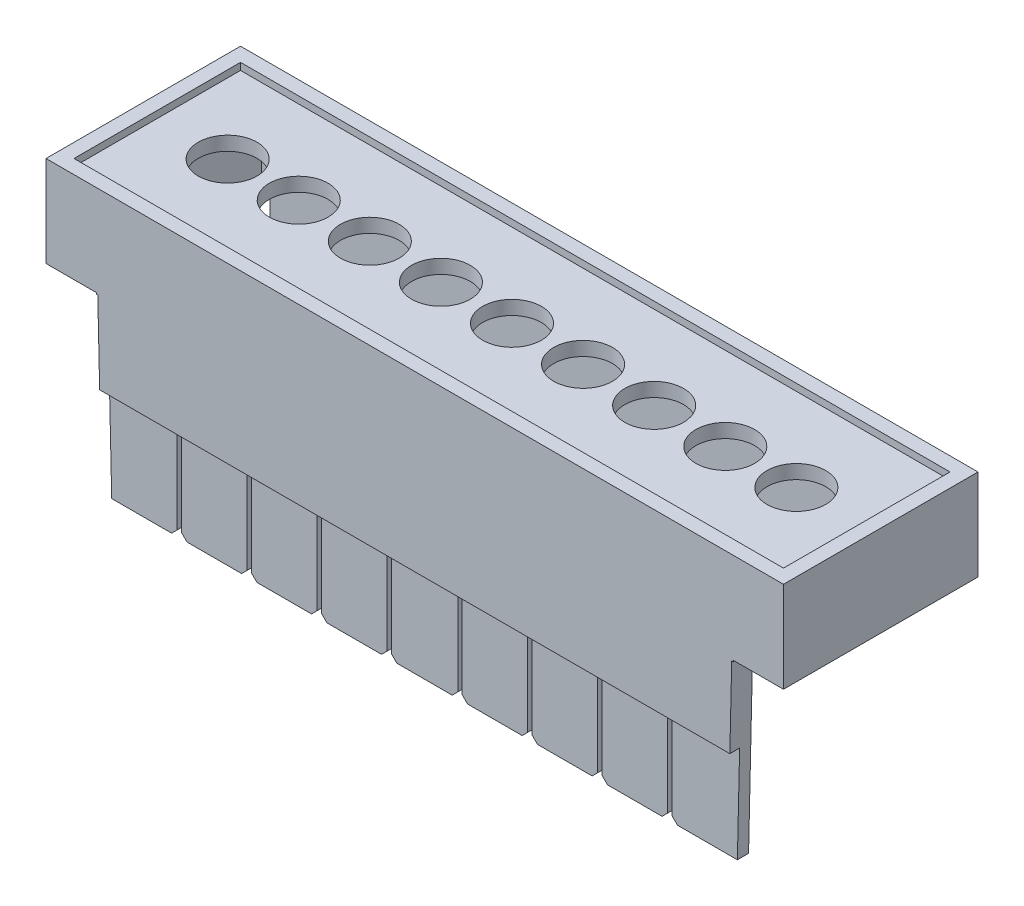
from build123d import *

# Parameters (mm, degrees)
SKETCH_1_W                 = 52.7
SKETCH_1_H                 = 13.9
EXTRUDE_1_DEPTH            = 11
SKETCH_2_W                 = 46.7
SKETCH_2_H                 = 10.9
CUT_EXTRUDE_1_DEPTH        = 9.5
SKETCH_3_W                 = 45.5
SKETCH_3_H                 = 1.5
EXTRUDE_2_DEPTH            = 8.4
SKETCH_4_W                 = 1
SKETCH_4_H                 = 7.5
CUT_EXTRUDE_2_DEPTH        = 51.794807806
CUT_EXTRUDE_3_DEPTH        = 3
PATTERN_LINEAR_1_COUNT     = 4
PATTERN_LINEAR_1_PITCH     = 5
CUT_EXTRUDE_4_DEPTH        = 3
PATTERN_LINEAR_2_COUNT     = 4
PATTERN_LINEAR_2_PITCH     = 5
SKETCH_7_W                 = 3.6
SKETCH_7_H                 = 5.5
CUT_EXTRUDE_5_DEPTH        = 32.757400712
SKETCH_8_W                 = 50.7
SKETCH_8_H                 = 11.9
CUT_EXTRUDE_6_DEPTH        = 0.5
SKETCH_9_R                 = 2.1
CUT_EXTRUDE_7_DEPTH        = 5
PATTERN_LINEAR_3_COUNT     = 5
PATTERN_LINEAR_3_PITCH     = 5.08
PATTERN_LINEAR_3_COL_COUNT = 5
PATTERN_LINEAR_3_COL_PITCH = 5.08
SKETCH_10_W                = 47.5
SKETCH_10_H                = 2
CUT_EXTRUDE_8_DEPTH        = 3
CUT_EXTRUDE_9_DEPTH        = 3


with BuildPart() as part:
    # Эскиз1 → Бобышка-Вытянуть1 (new body)
    with BuildSketch(Plane(origin=(0, 0, 0), x_dir=(1, 0, 0), z_dir=(0, 1, 0))):
        Rectangle(SKETCH_1_W, SKETCH_1_H)
    extrude(amount=EXTRUDE_1_DEPTH)

    # Эскиз2 → Вырез-Вытянуть1 (cut)
    with BuildSketch(Plane.XZ):
        Rectangle(SKETCH_2_W, SKETCH_2_H)
    extrude(amount=-CUT_EXTRUDE_1_DEPTH, mode=Mode.SUBTRACT)

    # Эскиз3 → Бобышка-Вытянуть2 (add)
    with BuildSketch(Plane.XZ):
        with Locations((0, 6.2)):
            Rectangle(SKETCH_3_W, SKETCH_3_H)
    extrude(amount=EXTRUDE_2_DEPTH)

    # Эскиз4 → Вырез-Вытянуть2 (cut, through all)
    with BuildSketch(Plane(origin=(22.75, 0, 0), x_dir=(0, 0, -1), z_dir=(1, 0, 0))):
        with Locations((-6.75, -5.15)):
            Rectangle(SKETCH_4_W, SKETCH_4_H)
    extrude(amount=-CUT_EXTRUDE_2_DEPTH, mode=Mode.SUBTRACT)

    # Эскиз5 → Вырез-Вытянуть3 (cut)
    with BuildSketch(Plane.XY.offset(6.25)):
        Polygon((-2.675, -1.4), (-2.675, -8), (-3.175, -8.5), (-3.675, -8.5), (-3.675, -9.5), (-1.375, -9.5), (-1.375, -8.5), (-1.875, -8.5), (-2.375, -8), (-2.375, -1.4), align=None)
    cut_extrude_3 = extrude(amount=-CUT_EXTRUDE_3_DEPTH, mode=Mode.SUBTRACT)

    # Линейный массив1: Вырез-Вытянуть3 ×4
    with Locations(*[(-i * PATTERN_LINEAR_1_PITCH, 0, 0) for i in range(1, PATTERN_LINEAR_1_COUNT)]):
        add(cut_extrude_3, mode=Mode.SUBTRACT)

    # Эскиз6 → Вырез-Вытянуть4 (cut)
    with BuildSketch(Plane.XY.offset(6.25)):
        Polygon((2.375, -1.4), (2.675, -1.4), (2.675, -8), (3.175, -8.5), (3.675, -8.5), (3.675, -9), (1.375, -9), (1.375, -8.5), (1.875, -8.5), (2.375, -8), align=None)
    cut_extrude_4 = extrude(amount=-CUT_EXTRUDE_4_DEPTH, mode=Mode.SUBTRACT)

    # Линейный массив2: Вырез-Вытянуть4 ×4
    with Locations(*[(i * PATTERN_LINEAR_2_PITCH, 0, 0) for i in range(1, PATTERN_LINEAR_2_COUNT)]):
        add(cut_extrude_4, mode=Mode.SUBTRACT)

    # Эскиз7 → Вырез-Вытянуть5 (cut, through all)
    with BuildSketch(Plane.XY.offset(6.95)):
        with Locations((-24.55, 1.75)):
            Rectangle(SKETCH_7_W, SKETCH_7_H)
        with Locations((24.55, 1.75)):
            Rectangle(SKETCH_7_W, SKETCH_7_H)
    extrude(amount=-CUT_EXTRUDE_5_DEPTH, mode=Mode.SUBTRACT)

    # Эскиз8 → Вырез-Вытянуть6 (cut)
    with BuildSketch(Plane(origin=(0, 11, 0), x_dir=(1, 0, 0), z_dir=(0, 1, 0))):
        Rectangle(SKETCH_8_W, SKETCH_8_H)
    extrude(amount=-CUT_EXTRUDE_6_DEPTH, mode=Mode.SUBTRACT)

    # Эскиз9 → Вырез-Вытянуть7 (cut)
    with BuildSketch(Plane(origin=(0, 10.5, 0), x_dir=(1, 0, 0), z_dir=(0, 1, 0))):
        with Locations(Location((0, 0, 0), (0, 0, 270))):
            Circle(SKETCH_9_R)
    cut_extrude_7 = extrude(amount=-CUT_EXTRUDE_7_DEPTH, mode=Mode.SUBTRACT)

    # Линейный массив3: Вырез-Вытянуть7 ×5
    with Locations(*[(-i * PATTERN_LINEAR_3_PITCH, 0, 0) for i in range(1, PATTERN_LINEAR_3_COUNT)]):
        add(cut_extrude_7, mode=Mode.SUBTRACT)

    # Линейный массив3 col: Вырез-Вытянуть7 ×5
    with Locations(*[(i * PATTERN_LINEAR_3_COL_PITCH, 0, 0) for i in range(1, PATTERN_LINEAR_3_COL_COUNT)]):
        add(cut_extrude_7, mode=Mode.SUBTRACT)

    # Эскиз10 → Вырез-Вытянуть8 (cut)
    with BuildSketch(Plane(origin=(0, 0, -6.95), x_dir=(-1, 0, 0), z_dir=(0, 0, -1))):
        Rectangle(SKETCH_10_W, SKETCH_10_H)
    extrude(amount=-CUT_EXTRUDE_8_DEPTH, mode=Mode.SUBTRACT)

    # Эскиз13 → Вырез-Вытянуть9 (cut)
    with BuildSketch(Plane.XY.offset(6.95)):
        Polygon((-26.35, 4.4), (-22.65, 4.4), (-22.35, -8.6), (-26.35, -8.6), align=None)
    cut_extrude_9 = extrude(amount=-CUT_EXTRUDE_9_DEPTH, mode=Mode.SUBTRACT)

    # Зеркальное отражение1: Вырез-Вытянуть9 across plane
    add(cut_extrude_9.mirror(Plane(origin=(0, 0, 0), x_dir=(0, 0, 1), z_dir=(1, 0, 0))), mode=Mode.SUBTRACT)


solid = part.part
